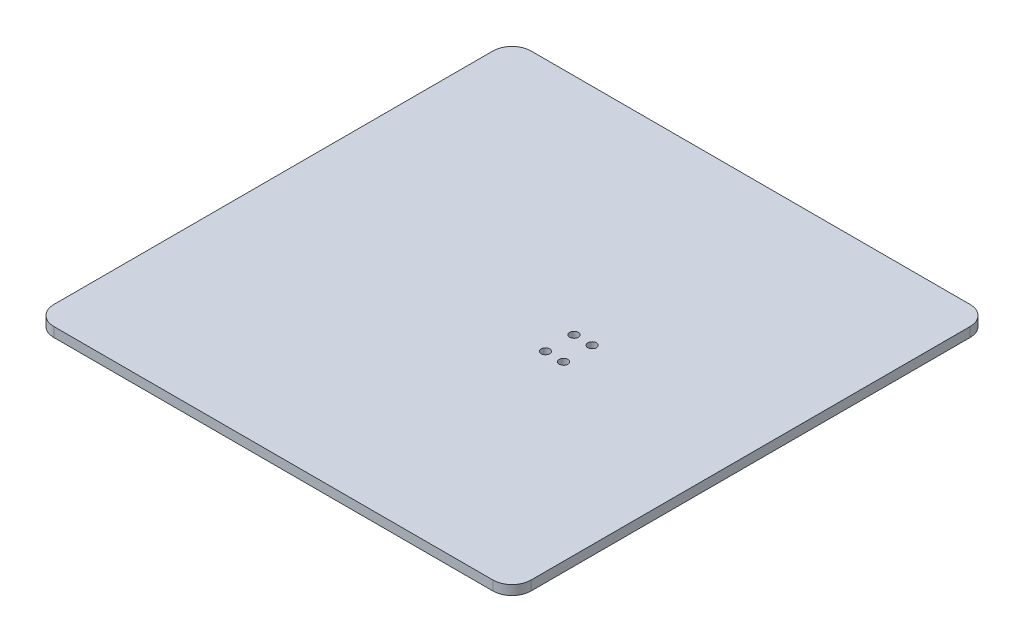
from build123d import *

# Parameters (mm, degrees)
SALIENTE_EXTRUIR1_DEPTH = 10
CORTAR_EXTRUIR2_DEPTH   = 354.694783677


with BuildPart() as part:
    # Croquis1 → Saliente-Extruir1 (new body)
    with BuildSketch(Plane(origin=(0, 0, 0), x_dir=(1, 0, 0), z_dir=(0, 1, 0))):
        with BuildLine():
            Line((-230, 250), (230, 250))
            ThreePointArc((230, 250), (244.142135624, 244.142135624), (250, 230))
            Line((250, 230), (250, -230))
            ThreePointArc((250, -230), (244.142135624, -244.142135624), (230, -250))
            Line((230, -250), (-230, -250))
            ThreePointArc((-230, -250), (-244.142135624, -244.142135624), (-250, -230))
            Line((-250, -230), (-250, 230))
            ThreePointArc((-250, 230), (-244.142135624, 244.142135624), (-230, 250))
        make_face()
    extrude(amount=SALIENTE_EXTRUIR1_DEPTH)

    # Croquis4 → Cortar-Extruir2 (cut, through all)
    with BuildSketch(Plane(origin=(0, 10, 0), x_dir=(1, 0, 0), z_dir=(0, 1, 0))):
        with BuildLine():
            ThreePointArc((73.5, -15), (72.181980515, -11.818019485), (69, -10.5))
            ThreePointArc((69, -10.5), (64.5, -15), (69, -19.5))
            ThreePointArc((69, -19.5), (72.181980515, -18.181980515), (73.5, -15))
        make_face()
        with BuildLine():
            ThreePointArc((54.5, -15), (53.181980515, -11.818019485), (50, -10.5))
            ThreePointArc((50, -10.5), (45.5, -15), (50, -19.5))
            ThreePointArc((50, -19.5), (53.181980515, -18.181980515), (54.5, -15))
        make_face()
        with BuildLine():
            ThreePointArc((54.5, 15), (53.181980515, 18.181980515), (50, 19.5))
            ThreePointArc((50, 19.5), (45.5, 15), (50, 10.5))
            ThreePointArc((50, 10.5), (53.181980515, 11.818019485), (54.5, 15))
        make_face()
        with BuildLine():
            ThreePointArc((73.5, 15), (72.181980515, 18.181980515), (69, 19.5))
            ThreePointArc((69, 19.5), (64.5, 15), (69, 10.5))
            ThreePointArc((69, 10.5), (72.181980515, 11.818019485), (73.5, 15))
        make_face()
    extrude(amount=-CORTAR_EXTRUIR2_DEPTH, mode=Mode.SUBTRACT)


solid = part.part
